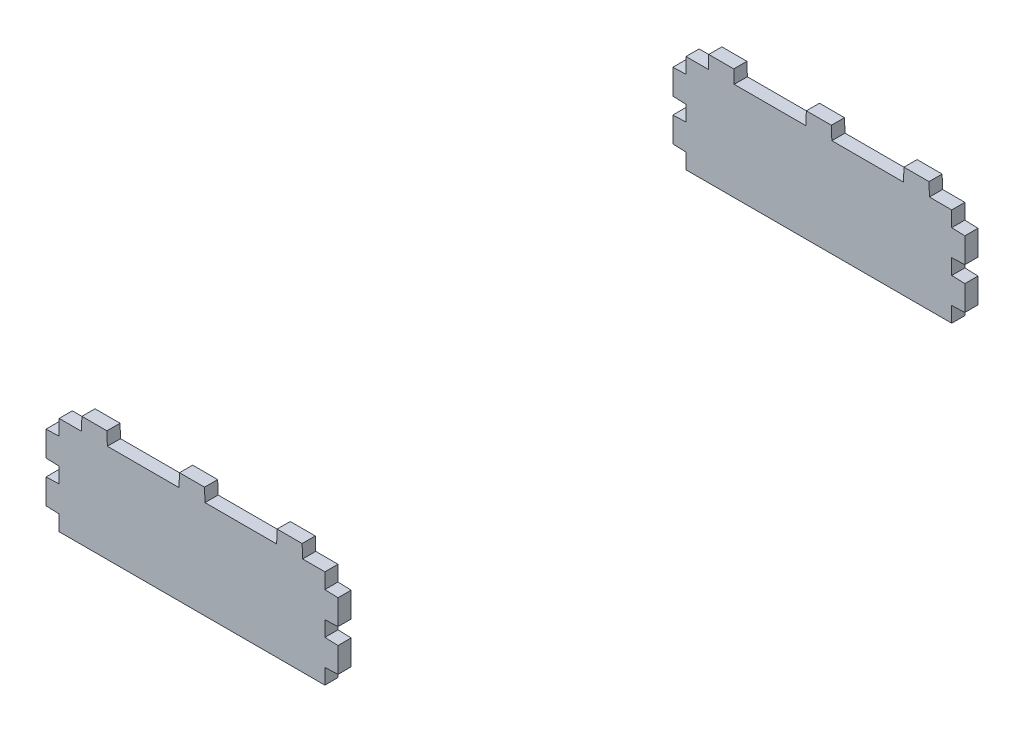
from build123d import *

# Parameters (mm, degrees)
BOSS_EXTRUDE1_DEPTH = 6


with BuildPart() as part:
    # Sketch1 → Boss-Extrude1 (new body)
    with BuildSketch(Plane(origin=(0, 0, -76.2), x_dir=(-1, 0, 0), z_dir=(0, 0, -1))):
        Polygon((-50.47683298, 44.8), (-50.267308364, 50.8), (-38.837308364, 50.8), (-38.627783747, 44.8), (-5.924524617, 44.8), (-5.715, 50.8), (5.715, 50.8), (5.924524617, 44.8), (38.627783747, 44.8), (38.837308364, 50.8), (50.267308364, 50.8), (50.47683298, 44.8), (60.63683298, 44.8), (60.63683298, 37.766032823), (66.63683298, 37.556508206), (66.63683298, 26.126508206), (60.63683298, 25.916983589), (60.63683298, 18.883016411), (66.63683298, 18.673491794), (66.63683298, 7.243491794), (60.63683298, 7.033967177), (60.63683298, 0), (-60.63683298, 0), (-60.63683298, 7.033967177), (-66.63683298, 7.243491794), (-66.63683298, 18.673491794), (-60.63683298, 18.883016411), (-60.63683298, 25.916983589), (-66.63683298, 26.126508206), (-66.63683298, 37.556508206), (-60.63683298, 37.766032823), (-60.63683298, 44.8), align=None)
    extrude(amount=-BOSS_EXTRUDE1_DEPTH)


with BuildPart() as body_2:
    # Mirror1: mirrored copy
    add(part.part.mirror(Plane(origin=(0, 0, 69.85), x_dir=(1, 0, 0), z_dir=(0, 0, -1))))


solid = Compound([part.part, body_2.part])
